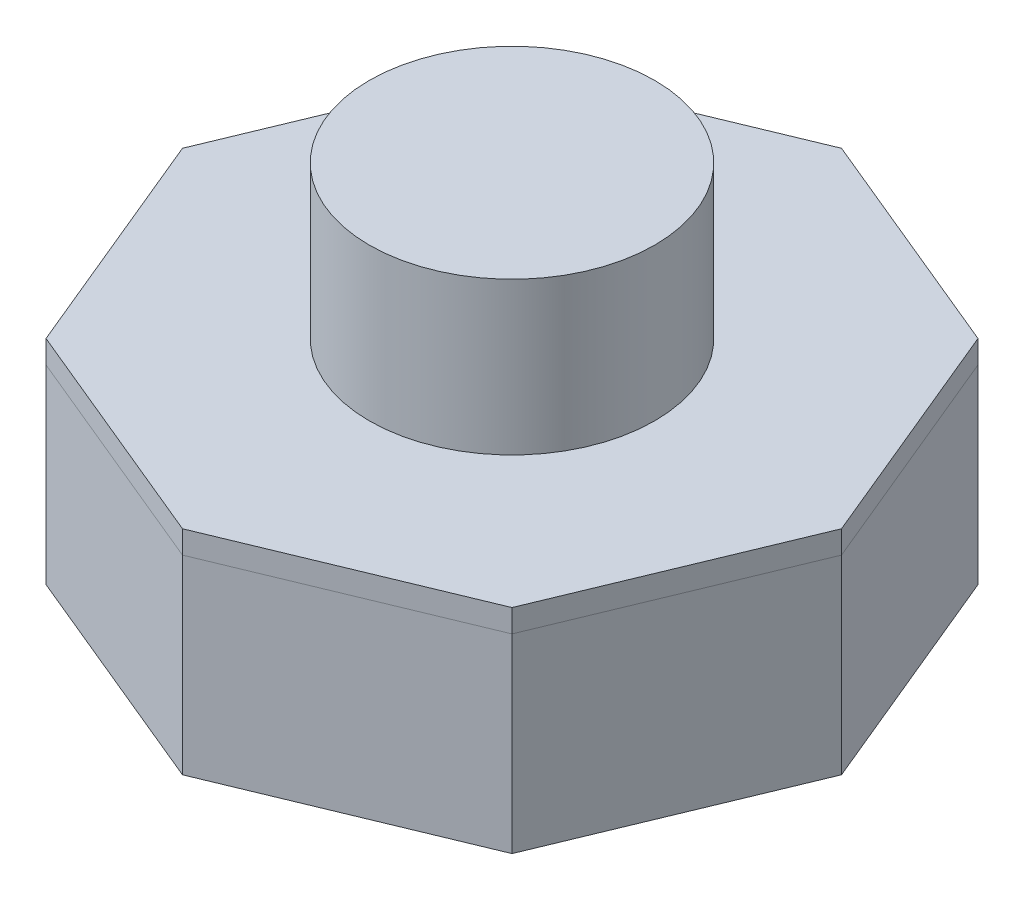
from build123d import *

# Parameters (mm, degrees)
BOSS_EXTRUDE1_DEPTH = 1.2
SKETCH2_R           = 7.5
BOSS_EXTRUDE2_DEPTH = 8
BOSS_EXTRUDE3_DEPTH = 10


with BuildPart() as part:
    # Sketch1 → Boss-Extrude1 (new body)
    with BuildSketch(Plane(origin=(0, 0, 0), x_dir=(1, 0, 0), z_dir=(0, 1, 0))):
        Polygon((0, -17.318275205), (12.245869836, -12.245869836), (17.318275205, 0), (12.245869836, 12.245869836), (0, 17.318275205), (-12.245869836, 12.245869836), (-17.318275205, 0), (-12.245869836, -12.245869836), align=None)
    extrude(amount=BOSS_EXTRUDE1_DEPTH)

    # Sketch2 → Boss-Extrude2 (add)
    with BuildSketch(Plane(origin=(0, 1.2, 0), x_dir=(1, 0, 0), z_dir=(0, 1, 0))):
        with Locations(Location((0, 0, 0), (0, 0, 270))):
            Circle(SKETCH2_R)
    extrude(amount=BOSS_EXTRUDE2_DEPTH)


with BuildPart() as body_2:
    # Sketch3 → Boss-Extrude3 (new body)
    with BuildSketch(Plane.XZ):
        Polygon((12.245869836, 12.245869836), (0, 17.318275205), (-12.245869836, 12.245869836), (-17.318275205, 0), (-12.245869836, -12.245869836), (0, -17.318275205), (12.245869836, -12.245869836), (17.318275205, 0), align=None)
    extrude(amount=BOSS_EXTRUDE3_DEPTH)


solid = Compound([part.part, body_2.part])
